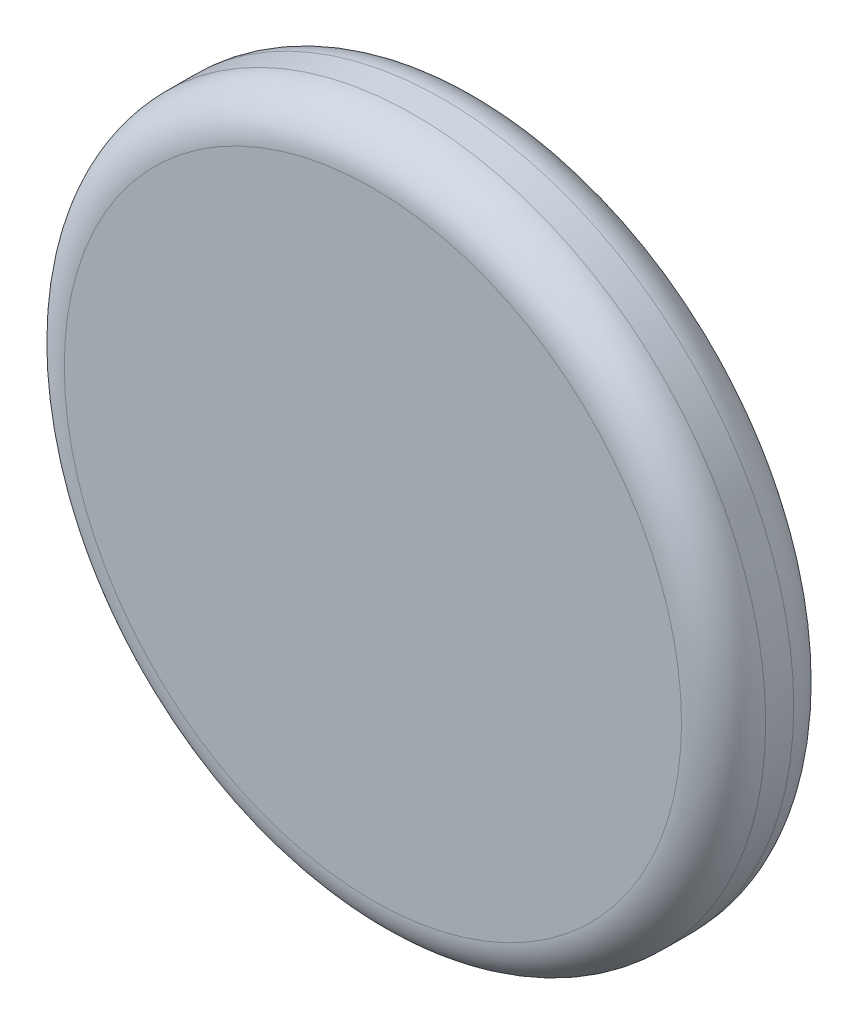
from build123d import *

# Parameters (mm, degrees)
SKETCH1_R           = 12.5
BOSS_EXTRUDE1_DEPTH = 4
FILLET2_R           = 1.5


with BuildPart() as part:
    # Sketch1 → Boss-Extrude1 (new body)
    with BuildSketch(Plane.XY):
        Circle(SKETCH1_R)
    extrude(amount=BOSS_EXTRUDE1_DEPTH)

    # Fillet2
    fillet2_edges = [part.edges().sort_by_distance(p)[0] for p in [
        (-12.5, 0, 0),
        (-12.5, 0, 4),
    ]]
    fillet(fillet2_edges, radius=FILLET2_R)


solid = part.part
